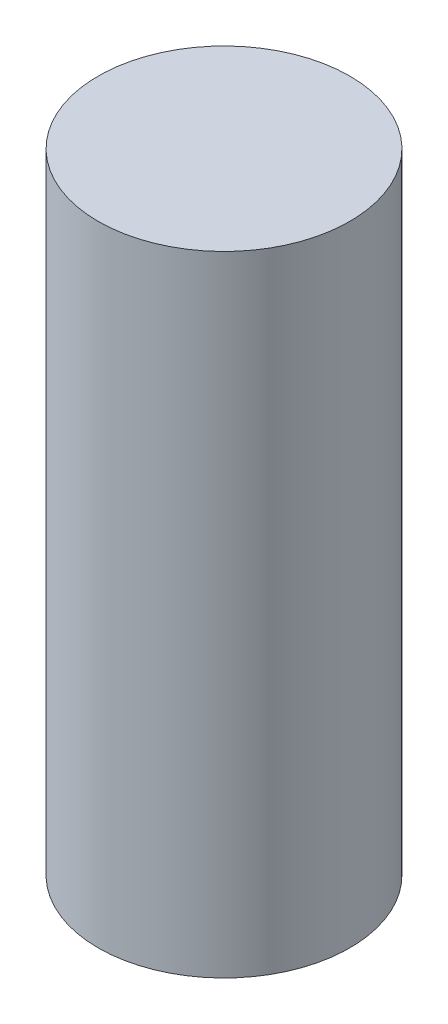
from build123d import *

# Parameters (mm, degrees)
CROQUIS1_R              = 2
SALIENTE_EXTRUIR1_DEPTH = 5


with BuildPart() as part:
    # Croquis1 → Saliente-Extruir1 (new, symmetric)
    with BuildSketch(Plane(origin=(0, 0, 0), x_dir=(1, 0, 0), z_dir=(0, 1, 0))):
        with Locations(Location((0, 0, 0), (0, 0, 270))):
            Circle(CROQUIS1_R)
    extrude(amount=SALIENTE_EXTRUIR1_DEPTH, both=True)


solid = part.part
